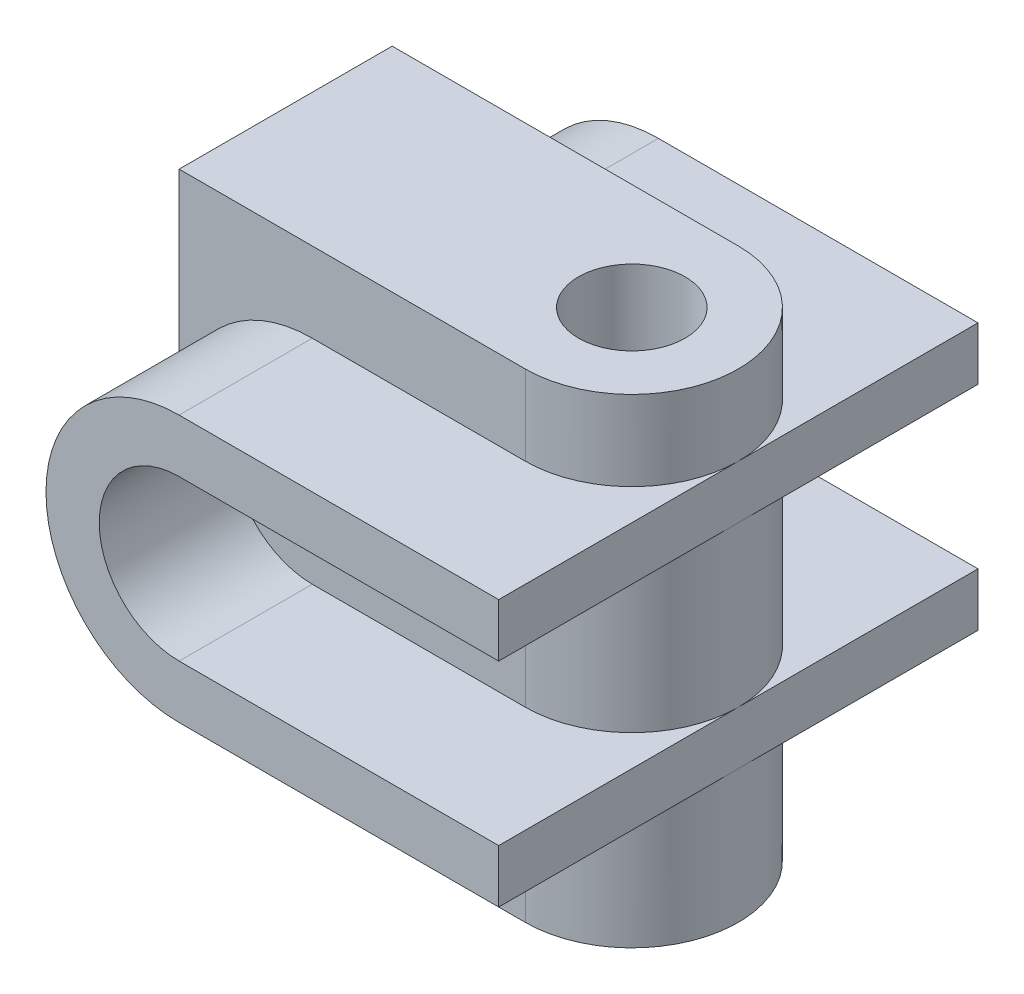
from build123d import *

# Parameters (mm, degrees)
EXTRUDE_THIN1_DEPTH = 90
SKETCH2_R           = 10
BOSS_EXTRUDE1_DEPTH = 90


with BuildPart() as part:
    # Sketch1 → Extrude-Thin1 (new body)
    with BuildSketch(Plane.XY):
        with BuildLine():
            Line((0, -15), (-60, -15))
            ThreePointArc((-60, -15), (-85, -40), (-60, -65))
            Line((-60, -65), (0, -65))
            Line((0, -65), (0, -55))
            Line((0, -55), (-60, -55))
            ThreePointArc((-60, -55), (-75, -40), (-60, -25))
            Line((-60, -25), (0, -25))
            Line((0, -25), (0, -15))
        make_face()
    extrude(amount=EXTRUDE_THIN1_DEPTH)


with BuildPart() as body_2:
    # Sketch2 → Boss-Extrude1 (new body)
    with BuildSketch(Plane(origin=(0, 0, 0), x_dir=(1, 0, 0), z_dir=(0, 1, 0))):
        with BuildLine():
            Line((-85, -25), (-85, -65))
            Line((-85, -65), (-20, -65))
            ThreePointArc((-20, -65), (0, -45), (-20, -25))
            Line((-20, -25), (-85, -25))
        make_face()
        with Locations((-20, -45)):
            Circle(SKETCH2_R, mode=Mode.SUBTRACT)
    extrude(amount=-BOSS_EXTRUDE1_DEPTH)


with BuildPart() as part_1:
    add(part.part)

    # official_combine_multi_inter: union body 2
    add(body_2.part)


solid = part_1.part
